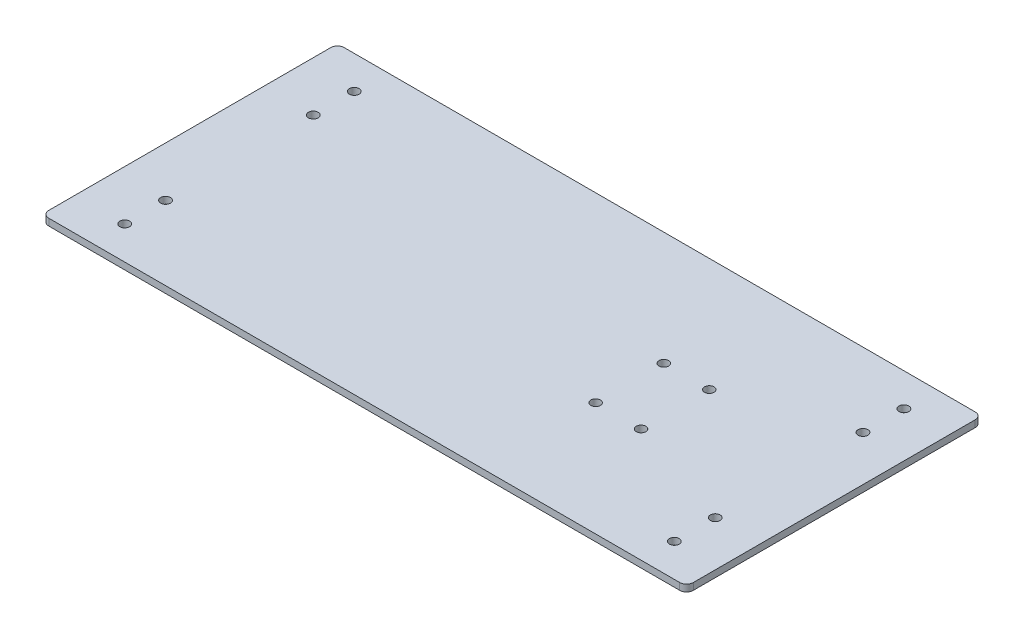
from build123d import *

# Parameters (mm, degrees)
SKETCH_1_W          = 283.58
SKETCH_1_H          = 111
SKETCH_1_R          = 2.15
EXTRUDE_1_DEPTH     = 3
SKETCH_2_W          = 283.58
SKETCH_2_H          = 9.5
EXTRUDE_2_DEPTH     = 3
FILLET_1_R          = 3
SKETCH_3_R          = 2.1
CUT_EXTRUDE_1_DEPTH = 10


with BuildPart() as part:
    # 草图1 → 凸台-拉伸1 (new body)
    with BuildSketch(Plane(origin=(0, 0, 0), x_dir=(1, 0, 0), z_dir=(0, 1, 0))):
        Rectangle(SKETCH_1_W, SKETCH_1_H)
        with Locations(Location((121.925, 50.5, 0), (0, 0, 270))):
            Circle(SKETCH_1_R, mode=Mode.SUBTRACT)
        with Locations(Location((121.925, 32.5, 0), (0, 0, 270))):
            Circle(SKETCH_1_R, mode=Mode.SUBTRACT)
        with Locations(Location((121.925, -32.5, 0), (0, 0, 270))):
            Circle(SKETCH_1_R, mode=Mode.SUBTRACT)
        with Locations(Location((121.925, -50.5, 0), (0, 0, 270))):
            Circle(SKETCH_1_R, mode=Mode.SUBTRACT)
        with Locations(Location((-119.925, 50.52, 0), (0, 0, 270))):
            Circle(SKETCH_1_R, mode=Mode.SUBTRACT)
        with Locations(Location((-119.925, 32.5, 0), (0, 0, 270))):
            Circle(SKETCH_1_R, mode=Mode.SUBTRACT)
        with Locations(Location((-119.925, -32.5, 0), (0, 0, 270))):
            Circle(SKETCH_1_R, mode=Mode.SUBTRACT)
        with Locations(Location((-119.925, -50.48, 0), (0, 0, 270))):
            Circle(SKETCH_1_R, mode=Mode.SUBTRACT)
    extrude(amount=EXTRUDE_1_DEPTH)

    # 草图2 → 凸台-拉伸2 (add)
    with BuildSketch(Plane(origin=(0, 0, 0), x_dir=(-1, 0, 0), z_dir=(0, -1, 0))):
        with Locations((0, -60.25)):
            Rectangle(SKETCH_2_W, SKETCH_2_H)
        with Locations((0, 60.25)):
            Rectangle(SKETCH_2_W, SKETCH_2_H)
    extrude(amount=-EXTRUDE_2_DEPTH)

    # 圆角1
    fillet_1_edges = [part.edges().sort_by_distance(p)[0] for p in [
        (-141.79, 1.5, 65),
        (141.79, 1.5, 65),
        (-141.79, 1.5, -65),
        (141.79, 1.5, -65),
    ]]
    fillet(fillet_1_edges, radius=FILLET_1_R)

    # 草图3 → 切除-拉伸1 (cut)
    with BuildSketch(Plane(origin=(0, 0, 0), x_dir=(-1, 0, 0), z_dir=(0, -1, 0))):
        with Locations(Location((-71.79, -15, 0), (0, 0, 90))):
            Circle(SKETCH_3_R)
        with Locations(Location((-51.79, -15, 0), (0, 0, 90))):
            Circle(SKETCH_3_R)
        with Locations(Location((-51.79, 15, 0), (0, 0, 90))):
            Circle(SKETCH_3_R)
        with Locations(Location((-71.79, 15, 0), (0, 0, 90))):
            Circle(SKETCH_3_R)
    extrude(amount=-CUT_EXTRUDE_1_DEPTH, mode=Mode.SUBTRACT)


solid = part.part
